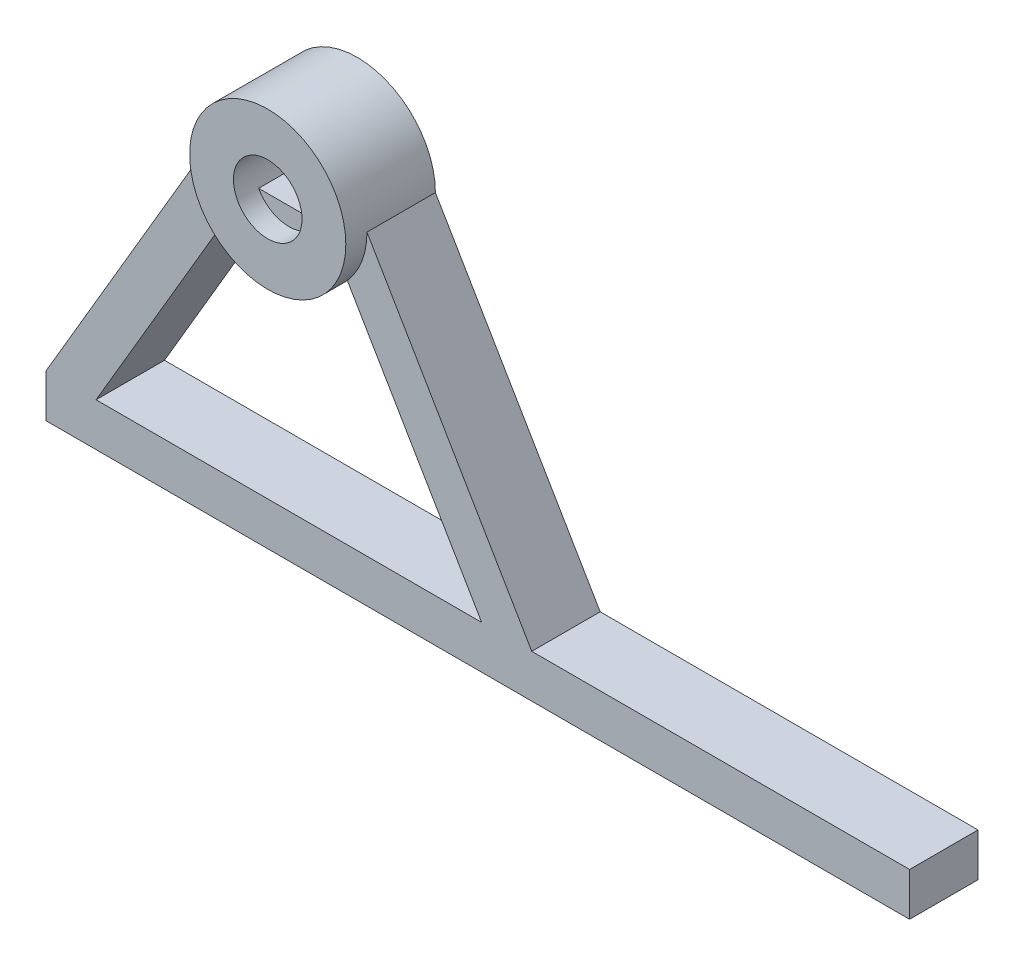
from build123d import *
from build123d.topology import SkipClean

# Parameters (mm, degrees)
BOSS_EXTRUDE1_DEPTH = 6.34
SKETCH6_R           = 7.235705293
SKETCH6_R_2         = 3.175
BOSS_EXTRUDE2_DEPTH = 1.96
SKETCH8_W           = 6.34
SKETCH8_H           = 4
BOSS_EXTRUDE4_DEPTH = 35


with BuildPart() as part:
    # Sketch1 → Boss-Extrude1 (new body)
    # profile 1 of 5: a face of its own
    with BuildSketch(Plane.XY):
        with BuildLine():
            ThreePointArc((7.235705293, 8.31996617), (0, 15.555671463), (-7.235705293, 8.31996617))
            ThreePointArc((-7.235705293, 8.31996617), (-6.76521969, 5.753405509), (-5.414947438, 3.520614617))
            Line((-5.414947438, 3.520614617), (-3.113806984, 7.440196422))
            ThreePointArc((-3.113806984, 7.440196422), (0, 11.555671463), (3.113806984, 7.440196422))
            Line((3.113806984, 7.440196422), (5.414947438, 3.520614617))
            ThreePointArc((5.414947438, 3.520614617), (6.76521969, 5.753405509), (7.235705293, 8.31996617))
        make_face()
    # profile 2 of 5: a face of its own
    with BuildSketch(Plane.XY):
        with BuildLine():
            Line((-7.235705293, 8.31996617), (-22.5, -17.68003383))
            Line((-22.5, -17.68003383), (-22.5, -21.68003383))
            Line((-22.5, -21.68003383), (22.5, -21.68003383))
            Line((22.5, -21.68003383), (22.5, -17.68003383))
            Line((22.5, -17.68003383), (7.235705293, 8.31996617))
            ThreePointArc((7.235705293, 8.31996617), (6.76521969, 5.753405509), (5.414947438, 3.520614617))
            Line((5.414947438, 3.520614617), (17.861599202, -17.68003383))
            Line((17.861599202, -17.68003383), (-17.861599202, -17.68003383))
            Line((-17.861599202, -17.68003383), (-5.414947438, 3.520614617))
            ThreePointArc((-5.414947438, 3.520614617), (-6.76521969, 5.753405509), (-7.235705293, 8.31996617))
        make_face()
    # profile 3 of 5: a face of its own
    with BuildSketch(Plane.XY):
        with BuildLine():
            Line((-3.113806984, 7.440196422), (-5.414947438, 3.520614617))
            ThreePointArc((-5.414947438, 3.520614617), (0, 1.084260877), (5.414947438, 3.520614617))
            Line((5.414947438, 3.520614617), (3.113806984, 7.440196422))
            ThreePointArc((3.113806984, 7.440196422), (0, 11.555671463), (-3.113806984, 7.440196422))
        make_face()
        with BuildLine():
            ThreePointArc((-2.798325392, 6.81996617), (-3.175, 8.31996617), (-2.798325392, 9.81996617))
            ThreePointArc((-2.798325392, 9.81996617), (0, 11.49496617), (2.798325392, 9.81996617))
            ThreePointArc((2.798325392, 9.81996617), (3.079391833, 9.093251978), (3.175, 8.31996617))
            ThreePointArc((3.175, 8.31996617), (3.079391833, 7.546680362), (2.798325392, 6.81996617))
            ThreePointArc((2.798325392, 6.81996617), (0, 5.14496617), (-2.798325392, 6.81996617))
        make_face(mode=Mode.SUBTRACT)
    # profile 4 of 5: a face of its own
    with BuildSketch(Plane.XY):
        with BuildLine():
            Line((2.798325392, 6.81996617), (-2.798325392, 6.81996617))
            ThreePointArc((-2.798325392, 6.81996617), (0, 5.14496617), (2.798325392, 6.81996617))
        make_face()
    # profile 5 of 5: a face of its own
    with BuildSketch(Plane.XY):
        with BuildLine():
            ThreePointArc((2.798325392, 9.81996617), (0, 11.49496617), (-2.798325392, 9.81996617))
            Line((-2.798325392, 9.81996617), (2.798325392, 9.81996617))
        make_face()
    extrude(amount=BOSS_EXTRUDE1_DEPTH)

    # Sketch6 → Boss-Extrude2 (add)
    with SkipClean():  # the faces are left unmerged after this step: merging them gives an invalid solid
        with BuildSketch(Plane.XY.offset(6.34)):
            with Locations((0, 8.31996617)):
                Circle(SKETCH6_R)
            with Locations(Location((0, 8.31996617, 0), (0, 0, 151.807139439))):
                Circle(SKETCH6_R_2, mode=Mode.SUBTRACT)
        extrude(amount=BOSS_EXTRUDE2_DEPTH)

    # Sketch8 → Boss-Extrude4 (add)
    with SkipClean():  # the faces are left unmerged after this step: merging them gives an invalid solid
        with BuildSketch(Plane(origin=(22.5, 0, 0), x_dir=(0, 0, -1), z_dir=(1, 0, 0))):
            with Locations((-3.17, -19.68003383)):
                Rectangle(SKETCH8_W, SKETCH8_H)
        extrude(amount=BOSS_EXTRUDE4_DEPTH)


solid = part.part
